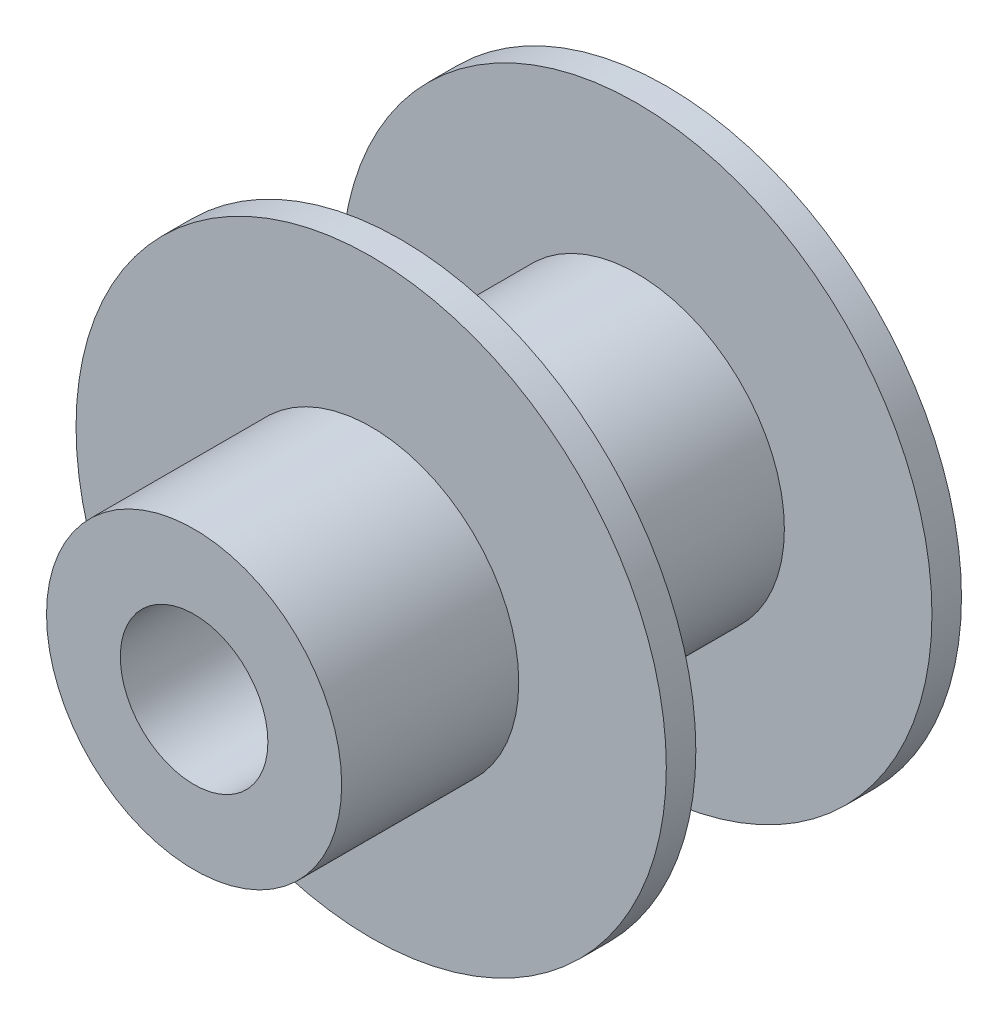
from build123d import *

# Parameters (mm, degrees)
ESQUISSE1_R             = 10
BOSS_EXTRU_1_DEPTH      = 10
ESQUISSE2_R             = 5
BOSS_EXTRU_2_DEPTH      = 6
ESQUISSE3_R             = 2.5
ENL_V_MAT_EXTRU_1_DEPTH = 22.354156504
ESQUISSE4_W             = 8
ESQUISSE4_H             = 5


with BuildPart() as part:
    # Esquisse1 → Boss.-Extru.1 (new body)
    with BuildSketch(Plane.XY):
        Circle(ESQUISSE1_R)
    extrude(amount=BOSS_EXTRU_1_DEPTH)

    # Esquisse2 → Boss.-Extru.2 (add)
    with BuildSketch(Plane.XY.offset(10)):
        Circle(ESQUISSE2_R)
    extrude(amount=BOSS_EXTRU_2_DEPTH)

    # Esquisse3 → Enlèv. mat.-Extru.1 (cut, through all)
    with BuildSketch(Plane.XY.offset(16)):
        Circle(ESQUISSE3_R)
    extrude(amount=-ENL_V_MAT_EXTRU_1_DEPTH, mode=Mode.SUBTRACT)

    # Esquisse4 → Enlèvement de matière-Révolution1 (revolve, cut)
    with BuildSketch(Plane(origin=(0, 0, 0), x_dir=(0, 0, -1), z_dir=(1, 0, 0)), mode=Mode.PRIVATE) as enl_vement_de_mati_re_r_volution1_sk:
        with Locations((-5, 7.5)):
            Rectangle(ESQUISSE4_W, ESQUISSE4_H)
    revolve(enl_vement_de_mati_re_r_volution1_sk.sketch.rotate(Axis((0, 0, 0), (0, 0, 1)), 90), axis=Axis((0, 0, 0), (0, 0, 1)), mode=Mode.SUBTRACT)


solid = part.part
